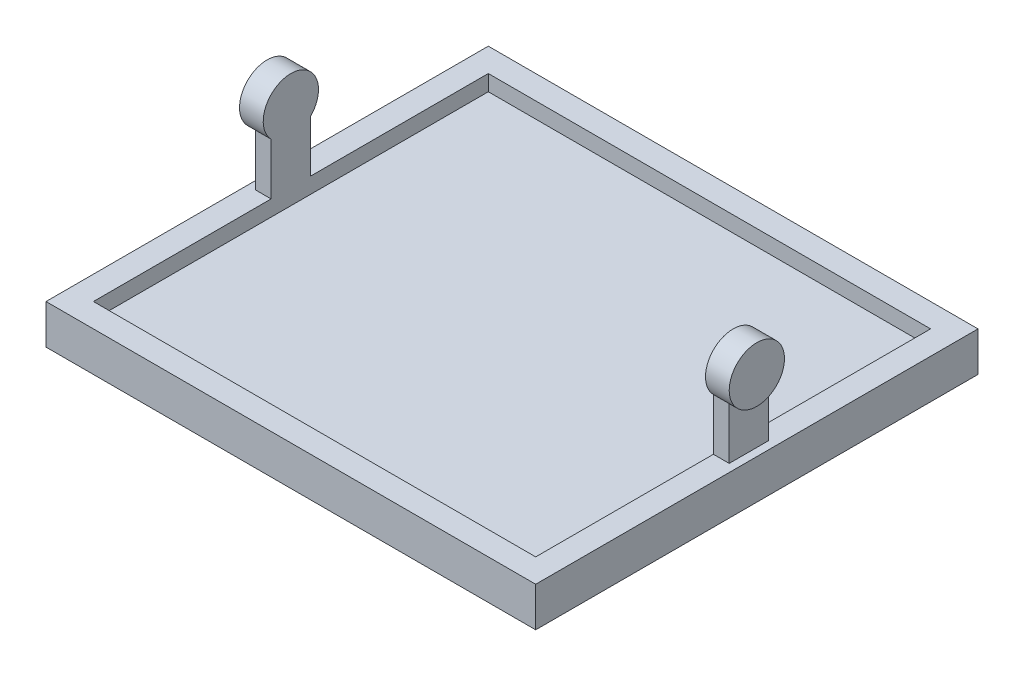
from build123d import *

# Parameters (mm, degrees)
SKETCH1_W           = 71.12
SKETCH1_H           = 63.5
INNER_LID_DEPTH     = 3.81
SKETCH1_5_W         = 78.74
SKETCH1_5_H         = 71.12
SKETCH1_5_W_2       = 71.12
SKETCH1_5_H_2       = 63.5
OUTER_LID_DEPTH     = 6.35
SKETCH2_W           = 2.54
SKETCH2_H           = 6.35
HOLE_SLIDES_DEPTH   = 11.43
SKETCH3_R           = 4.445
HOLE_LID_1_DEPTH    = 3.81
BOSS_EXTRUDE5_START = -3.81
SKETCH4_R           = 4.445
BOSS_EXTRUDE5_DEPTH = 3.81


with BuildPart() as part:
    # Sketch1 → inner-lid (new body)
    with BuildSketch(Plane(origin=(0, 0, 0), x_dir=(1, 0, 0), z_dir=(0, 1, 0))):
        Rectangle(SKETCH1_W, SKETCH1_H)
    extrude(amount=INNER_LID_DEPTH)

    # Sketch1<5> → outer-lid (add)
    with BuildSketch(Plane(origin=(0, 0, 0), x_dir=(1, 0, 0), z_dir=(0, 1, 0))):
        Rectangle(SKETCH1_5_W, SKETCH1_5_H)
        Rectangle(SKETCH1_5_W_2, SKETCH1_5_H_2, mode=Mode.SUBTRACT)
    extrude(amount=OUTER_LID_DEPTH)

    # Sketch2 → hole-slides (add)
    with BuildSketch(Plane(origin=(0, 6.35, 0), x_dir=(1, 0, 0), z_dir=(0, 1, 0))):
        with Locations((36.83, 0)):
            Rectangle(SKETCH2_W, SKETCH2_H)
        with Locations((-36.83, 0)):
            Rectangle(SKETCH2_W, SKETCH2_H)
    extrude(amount=HOLE_SLIDES_DEPTH)

    # Sketch3 → hole-lid-1 (add)
    with BuildSketch(Plane(origin=(-35.56, 0, 0), x_dir=(0, 0, -1), z_dir=(1, 0, 0))):
        with Locations((0, 17.78)):
            Circle(SKETCH3_R)
    extrude(amount=-HOLE_LID_1_DEPTH)

    # Sketch4 → Boss-Extrude5 (add)
    with BuildSketch(Plane.ZY.offset(-35.56).offset(BOSS_EXTRUDE5_START)):
        with Locations(Location((0, 17.78, 0), (0, 0, 180))):
            Circle(SKETCH4_R)
    extrude(amount=BOSS_EXTRUDE5_DEPTH)


solid = part.part
